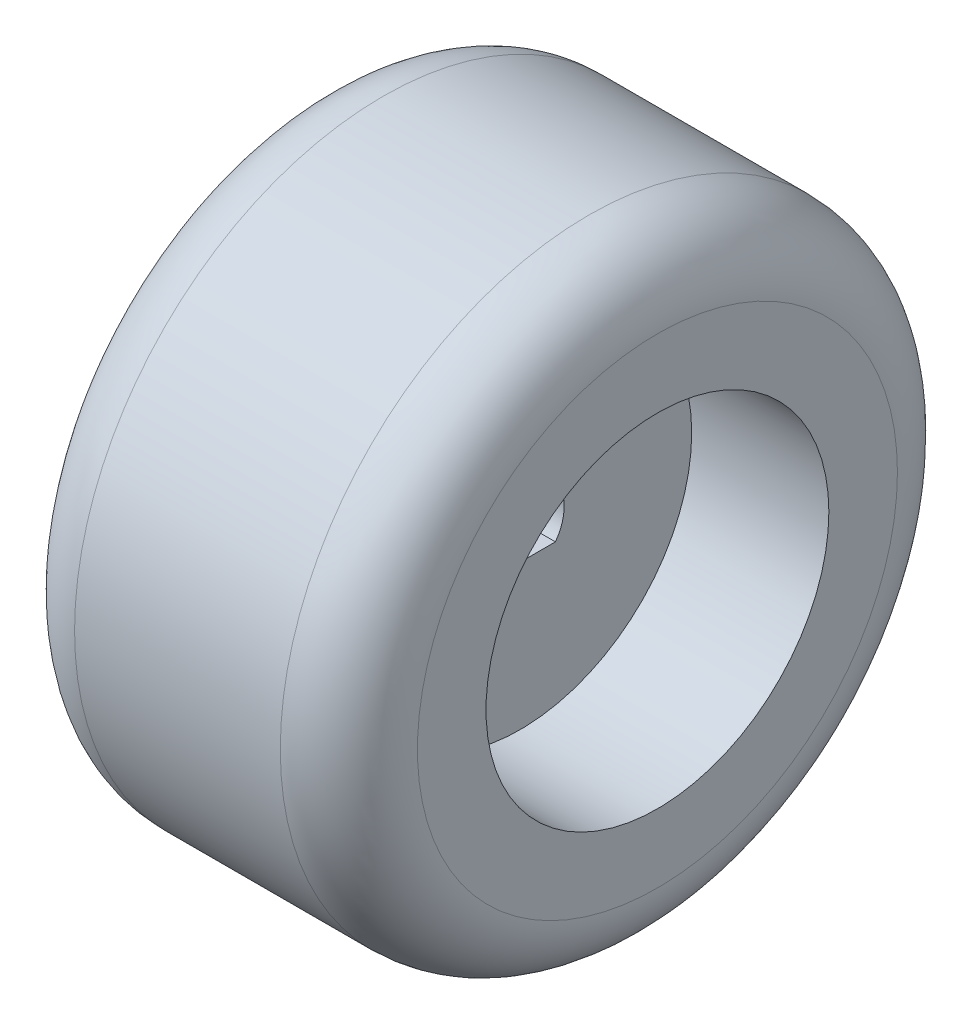
from build123d import *

# Parameters (mm, degrees)
SKETCH1_R           = 22.5
BOSS_EXTRUDE1_DEPTH = 25
SKETCH2_R           = 12.5
CUT_EXTRUDE1_DEPTH  = 10
FILLET1_R           = 5
SKETCH3_R           = 1.5
CUT_EXTRUDE2_DEPTH  = 41.466035196
CUT_EXTRUDE3_DEPTH  = 41.466035196


with BuildPart() as part:
    # Sketch1 → Boss-Extrude1 (new body)
    with BuildSketch(Plane(origin=(0, 0, 0), x_dir=(0, 0, -1), z_dir=(1, 0, 0))):
        Circle(SKETCH1_R)
    extrude(amount=BOSS_EXTRUDE1_DEPTH)

    # Sketch2 → Cut-Extrude1 (cut)
    with BuildSketch(Plane(origin=(25, 0, 0), x_dir=(0, 0, -1), z_dir=(1, 0, 0))):
        Circle(SKETCH2_R)
    extrude(amount=-CUT_EXTRUDE1_DEPTH, mode=Mode.SUBTRACT)

    # Fillet1
    fillet1_edges = [part.edges().sort_by_distance(p)[0] for p in [
        (0, 0, 22.5),
        (25, 0, 22.5),
    ]]
    fillet(fillet1_edges, radius=FILLET1_R)

    # Sketch3 → Cut-Extrude2 (cut, through all)
    with BuildSketch(Plane.ZY):
        Circle(SKETCH3_R)
    extrude(amount=-CUT_EXTRUDE2_DEPTH, mode=Mode.SUBTRACT)

    # Sketch4 → Cut-Extrude3 (cut, through all)
    with BuildSketch(Plane.ZY):
        with BuildLine():
            Line((-2.56, -1.92), (2.56, -1.92))
            ThreePointArc((2.56, -1.92), (3.2, 0), (2.56, 1.92))
            Line((2.56, 1.92), (-2.56, 1.92))
            ThreePointArc((-2.56, 1.92), (-3.2, 0), (-2.56, -1.92))
        make_face()
    extrude(amount=-CUT_EXTRUDE3_DEPTH, mode=Mode.SUBTRACT)


solid = part.part
